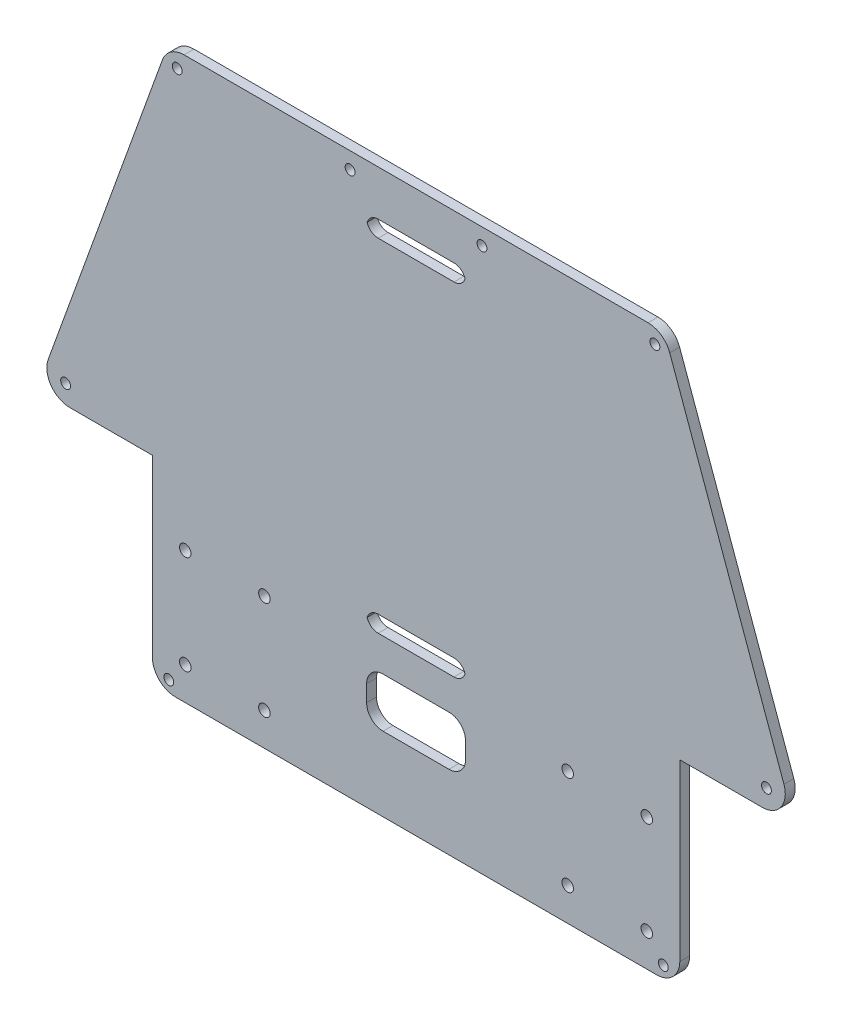
from build123d import *

# Parameters (mm, degrees)
SKETCH_2_R      = 1.75
SKETCH_2_R_2    = 1.5
EXTRUDE_2_DEPTH = 3


with BuildPart() as part:
    # 草图2 → 凸台-拉伸2 (new body)
    with BuildSketch(Plane.XY):
        with BuildLine():
            Line((-73, 0), (73, 0))
            ThreePointArc((73, 0), (77.949747468, 2.050252532), (80, 7))
            Line((80, 7), (80, 60))
            Line((80, 60), (105, 60))
            ThreePointArc((105, 60), (110.7284389, 62.976942983), (111.584524662, 69.375717782))
            Line((111.584524662, 69.375717782), (76.947414353, 165.375717782))
            ThreePointArc((76.947414353, 165.375717782), (74.385946708, 168.7284389), (70.362889691, 170))
            Line((70.362889691, 170), (-70.362889691, 170))
            ThreePointArc((-70.362889691, 170), (-74.385946708, 168.7284389), (-76.947414353, 165.375717782))
            Line((-76.947414353, 165.375717782), (-111.584524662, 69.375717782))
            ThreePointArc((-111.584524662, 69.375717782), (-110.7284389, 62.976942983), (-105, 60))
            Line((-105, 60), (-80, 60))
            Line((-80, 60), (-80, 7))
            ThreePointArc((-80, 7), (-77.949747468, 2.050252532), (-73, 0))
        make_face()
        with Locations((-70, 10)):
            Circle(SKETCH_2_R, mode=Mode.SUBTRACT)
        with Locations((-70, 40)):
            Circle(SKETCH_2_R, mode=Mode.SUBTRACT)
        with Locations(Location((-46, 40, 0), (0, 0, 180))):
            Circle(SKETCH_2_R, mode=Mode.SUBTRACT)
        with Locations(Location((-46, 10, 0), (0, 0, 180))):
            Circle(SKETCH_2_R, mode=Mode.SUBTRACT)
        with Locations((46, 10)):
            Circle(SKETCH_2_R, mode=Mode.SUBTRACT)
        with Locations((46, 40)):
            Circle(SKETCH_2_R, mode=Mode.SUBTRACT)
        with Locations(Location((70, 40, 0), (0, 0, 180))):
            Circle(SKETCH_2_R, mode=Mode.SUBTRACT)
        with Locations(Location((70, 10, 0), (0, 0, 180))):
            Circle(SKETCH_2_R, mode=Mode.SUBTRACT)
        with Locations((-72.441382232, 165.375717782)):
            Circle(SKETCH_2_R_2, mode=Mode.SUBTRACT)
        with Locations((-106.29148568, 65.75613767)):
            Circle(SKETCH_2_R_2, mode=Mode.SUBTRACT)
        with Locations(Location((106.29148568, 65.75613767, 0), (0, 0, 180))):
            Circle(SKETCH_2_R_2, mode=Mode.SUBTRACT)
        with Locations(Location((72.441382232, 165.375717782, 0), (0, 0, 180))):
            Circle(SKETCH_2_R_2, mode=Mode.SUBTRACT)
        with Locations((-20, 165)):
            Circle(SKETCH_2_R_2, mode=Mode.SUBTRACT)
        with Locations(Location((20, 165, 0), (0, 0, 180))):
            Circle(SKETCH_2_R_2, mode=Mode.SUBTRACT)
        with Locations((-75, 3.552033702)):
            Circle(SKETCH_2_R_2, mode=Mode.SUBTRACT)
        with Locations(Location((75, 3.552033702, 0), (0, 0, 180))):
            Circle(SKETCH_2_R_2, mode=Mode.SUBTRACT)
        with BuildLine():
            Line((-11.490577198, 151.277899951), (11.509422802, 151.277899951))
            ThreePointArc((11.509422802, 151.277899951), (13.601072868, 151.971656911), (14.863524768, 153.777899951))
            ThreePointArc((14.863524768, 153.777899951), (13.601072868, 155.584142991), (11.509422802, 156.277899951))
            Line((11.509422802, 156.277899951), (-11.490577198, 156.277899951))
            ThreePointArc((-11.490577198, 156.277899951), (-13.582227264, 155.584142991), (-14.844679164, 153.777899951))
            ThreePointArc((-14.844679164, 153.777899951), (-13.582227264, 151.971656911), (-11.490577198, 151.277899951))
        make_face(mode=Mode.SUBTRACT)
        with BuildLine():
            Line((-11.5, 47.5), (11.5, 47.5))
            ThreePointArc((11.5, 47.5), (13.591650066, 48.19375696), (14.854101966, 50))
            ThreePointArc((14.854101966, 50), (13.591650066, 51.80624304), (11.5, 52.5))
            Line((11.5, 52.5), (-11.5, 52.5))
            ThreePointArc((-11.5, 52.5), (-13.591650066, 51.80624304), (-14.854101966, 50))
            ThreePointArc((-14.854101966, 50), (-13.591650066, 48.19375696), (-11.5, 47.5))
        make_face(mode=Mode.SUBTRACT)
        with BuildLine():
            Line((-10, 22.5), (10, 22.5))
            ThreePointArc((10, 22.5), (13.535533906, 23.964466094), (15, 27.5))
            Line((15, 27.5), (15, 32.5))
            ThreePointArc((15, 32.5), (13.535533906, 36.035533906), (10, 37.5))
            Line((10, 37.5), (-10, 37.5))
            ThreePointArc((-10, 37.5), (-13.535533906, 36.035533906), (-15, 32.5))
            Line((-15, 32.5), (-15, 27.5))
            ThreePointArc((-15, 27.5), (-13.535533906, 23.964466094), (-10, 22.5))
        make_face(mode=Mode.SUBTRACT)
    extrude(amount=EXTRUDE_2_DEPTH)


solid = part.part
